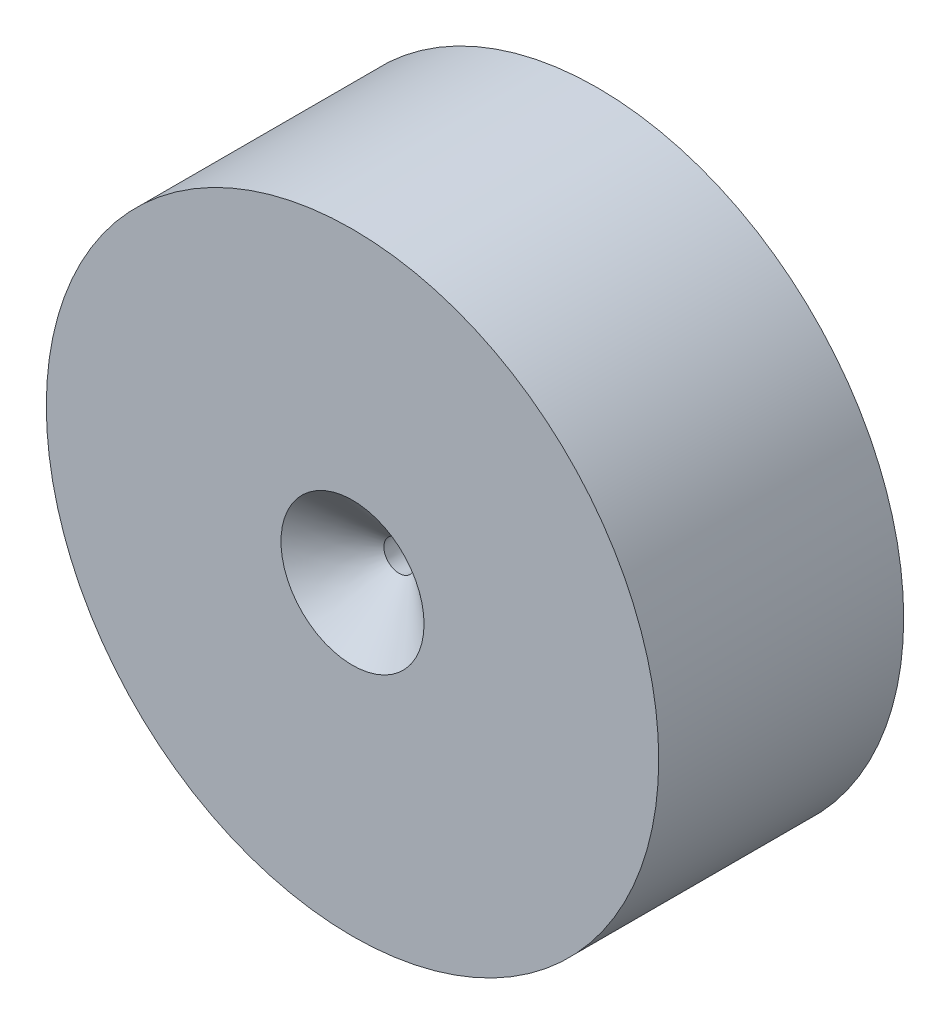
from build123d import *

# Parameters (mm, degrees)
SKETCH1_R           = 5
BOSS_EXTRUDE1_DEPTH = 4


with BuildPart() as part:
    # Sketch1 → Boss-Extrude1 (new body)
    with BuildSketch(Plane.XY):
        Circle(SKETCH1_R)
    extrude(amount=BOSS_EXTRUDE1_DEPTH)

    # Sketch2 → Cut-Revolve1 (revolve, cut)
    with BuildSketch(Plane(origin=(0, 0, 0), x_dir=(0, 0, -1), z_dir=(1, 0, 0)), mode=Mode.PRIVATE) as cut_revolve1_sk:
        Polygon((-4, 1.168053814), (-3.237936888, 0.25), (-1.307819962, 0.5), (0, 2), (0, 0), (-4, 0), align=None)
    revolve(cut_revolve1_sk.sketch.rotate(Axis((0, 0, 0), (0, 0, 1)), 90), axis=Axis((0, 0, 0), (0, 0, 1)), mode=Mode.SUBTRACT)


solid = part.part
